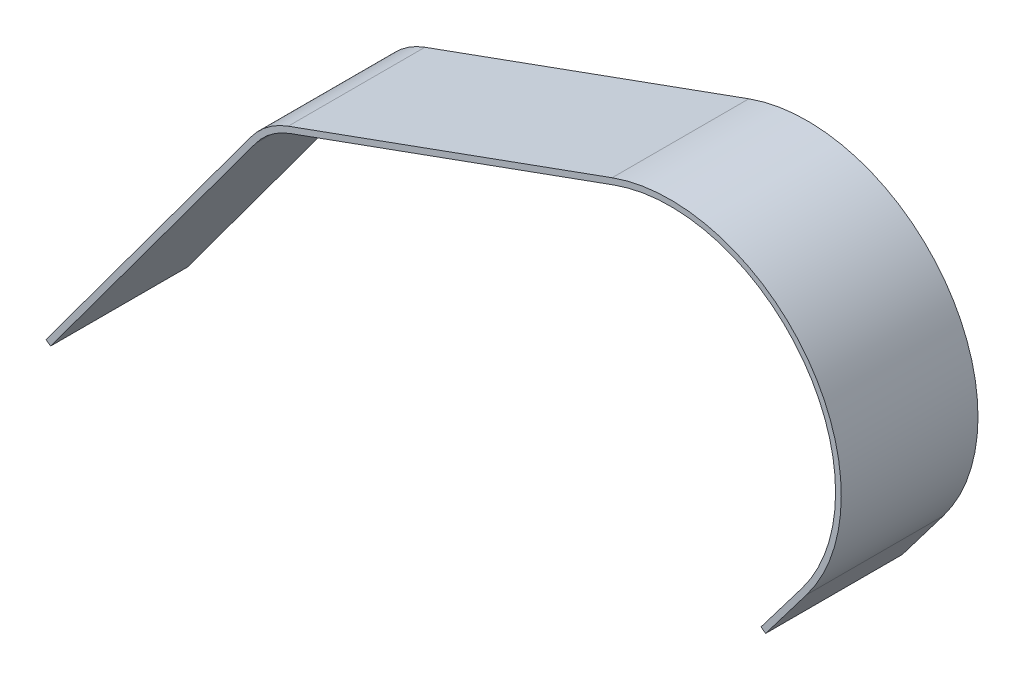
from build123d import *

# Parameters (mm, degrees)
EXTRUDE_THIN1_DEPTH = 76.2


with BuildPart() as part:
    # Sketch1 → Extrude-Thin1 (new body)
    with BuildSketch(Plane.XY):
        with BuildLine():
            Line((-171.530725158, -169.540176263), (-57.207776809, -14.493356815))
            ThreePointArc((-57.207776809, -14.493356815), (-48.029088686, -5.258412911), (-36.568222458, 0.920668726))
            Line((-36.568222458, 0.920668726), (143.952557391, 66.301099815))
            ThreePointArc((143.952557391, 66.301099815), (253.095507904, 33.210999285), (252.264699452, -80.834816757))
            Line((252.264699452, -80.834816757), (229.469051384, -110.874685447))
            Line((229.469051384, -110.874685447), (226.93983158, -108.955395947))
            Line((226.93983158, -108.955395947), (249.735479648, -78.915527258))
            ThreePointArc((249.735479648, -78.915527258), (250.538594484, 31.328761583), (145.033742323, 63.315858762))
            Line((145.033742323, 63.315858762), (-35.487037526, -2.064572327))
            ThreePointArc((-35.487037526, -2.064572327), (-46.129270453, -7.80229099), (-54.652337995, -16.377596044))
            Line((-54.652337995, -16.377596044), (-168.975286345, -171.424415492))
            Line((-168.975286345, -171.424415492), (-171.530725158, -169.540176263))
        make_face()
    extrude(amount=EXTRUDE_THIN1_DEPTH)


solid = part.part
